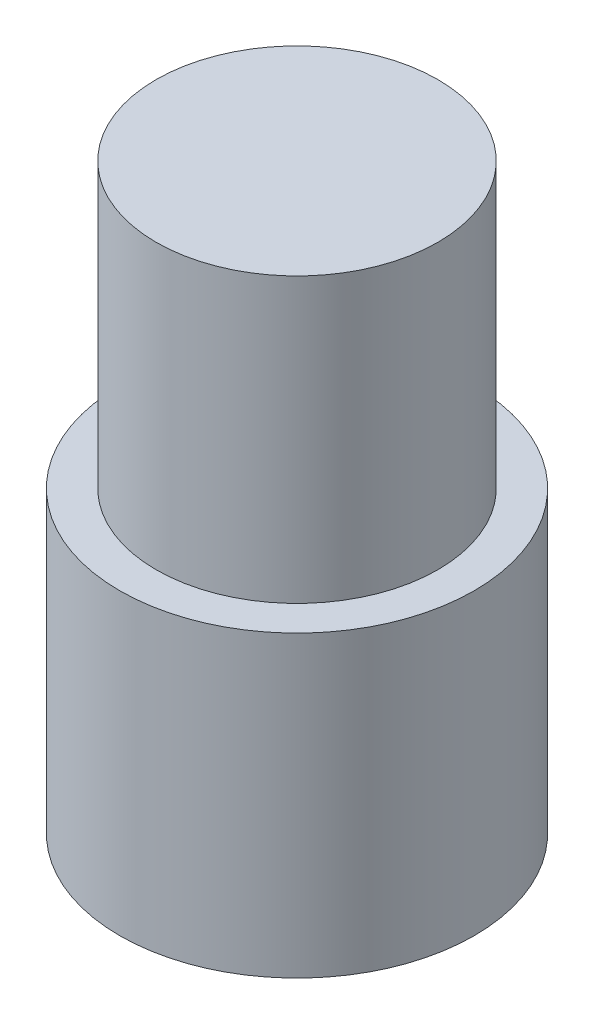
from build123d import *


with BuildPart() as part:
    # Sketch1 → Revolve1 (revolve)
    with BuildSketch(Plane(origin=(0, 0, 0), x_dir=(0, 0, -1), z_dir=(1, 0, 0))):
        Polygon((0, 101.15625), (39.75, 101.15625), (39.75, 21.15625), (50, 21.15625), (50, -63.13125), (0, -63.13125), align=None)
    revolve(axis=Axis((0, -2571.436331505, 0), (0, 1, 0)))


solid = part.part
